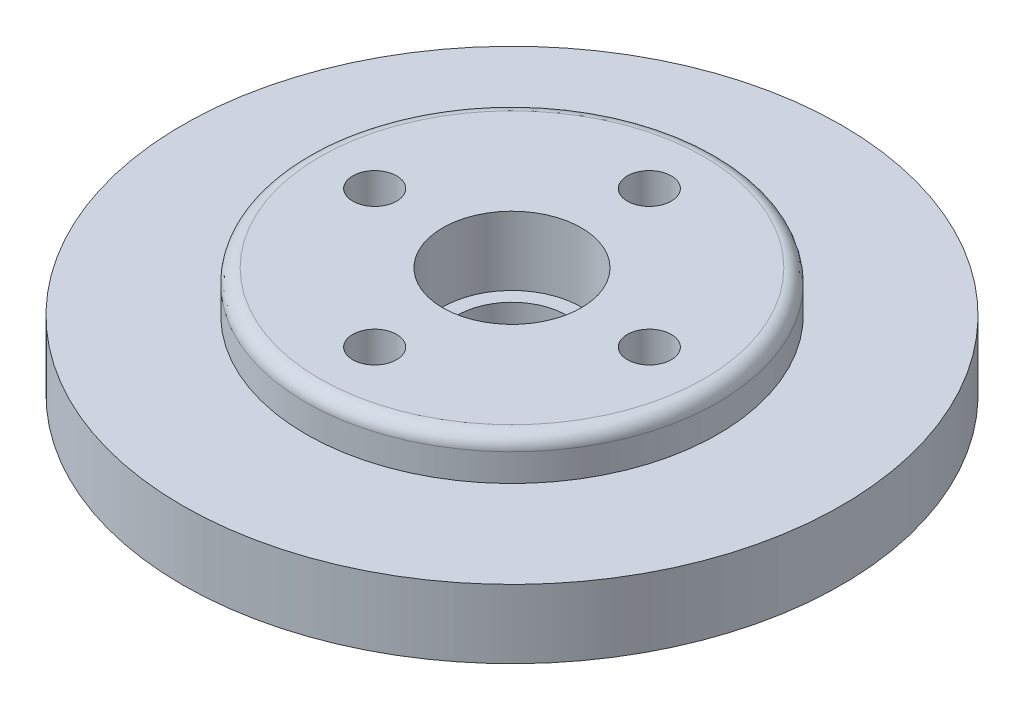
from build123d import *

# Parameters (mm, degrees)
SKETCH1_R           = 24
SKETCH1_R_2         = 4
BOSS_EXTRUDE1_DEPTH = 5
SKETCH2_R           = 15
BOSS_EXTRUDE2_DEPTH = 3
SKETCH4_R           = 5.05
CUT_EXTRUDE2_DEPTH  = 5
FILLET1_R           = 1
SKETCH5_R           = 1.6
CUT_EXTRUDE3_DEPTH  = 35.871191548
CUT_EXTRUDE15_DEPTH = 3


with BuildPart() as part:
    # Sketch1 → Boss-Extrude1 (new body)
    with BuildSketch(Plane(origin=(0, 0, 0), x_dir=(1, 0, 0), z_dir=(0, 1, 0))):
        with Locations(Location((0, 0, 0), (0, 0, 270))):
            Circle(SKETCH1_R)
        with Locations(Location((0, 0, 0), (0, 0, 270))):
            Circle(SKETCH1_R_2, mode=Mode.SUBTRACT)
    extrude(amount=BOSS_EXTRUDE1_DEPTH)

    # Sketch2 → Boss-Extrude2 (add)
    with BuildSketch(Plane(origin=(0, 5, 0), x_dir=(1, 0, 0), z_dir=(0, 1, 0))):
        with Locations(Location((0, 0, 0), (0, 0, 270))):
            Circle(SKETCH2_R)
    extrude(amount=BOSS_EXTRUDE2_DEPTH)

    # Sketch4 → Cut-Extrude2 (cut)
    with BuildSketch(Plane(origin=(0, 8, 0), x_dir=(1, 0, 0), z_dir=(0, 1, 0))):
        with Locations(Location((0, 0, 0), (0, 0, 270))):
            Circle(SKETCH4_R)
    extrude(amount=-CUT_EXTRUDE2_DEPTH, mode=Mode.SUBTRACT)

    # Fillet1
    fillet1_edges = [part.edges().sort_by_distance(p)[0] for p in [
        (0, 8, -15),
    ]]
    fillet(fillet1_edges, radius=FILLET1_R)

    # Sketch5 → Cut-Extrude3 (cut, through all)
    with BuildSketch(Plane(origin=(0, 8, 0), x_dir=(1, 0, 0), z_dir=(0, 1, 0))):
        with Locations(Location((0, 10, 0), (0, 0, 270))):
            Circle(SKETCH5_R)
        with Locations(Location((-10, 0, 0), (0, 0, 270))):
            Circle(SKETCH5_R)
        with Locations(Location((0, -10, 0), (0, 0, 270))):
            Circle(SKETCH5_R)
        with Locations(Location((10, 0, 0), (0, 0, 270))):
            Circle(SKETCH5_R)
    extrude(amount=-CUT_EXTRUDE3_DEPTH, mode=Mode.SUBTRACT)

    # Sketch10 → Cut-Extrude15 (cut)
    with BuildSketch(Plane.XZ):
        Polygon((10, -3.1), (12.684678752, -1.55), (12.684678752, 1.55), (10, 3.1), (7.315321248, 1.55), (7.315321248, -1.55), align=None)
        Polygon((3.1, 10), (1.55, 12.684678752), (-1.55, 12.684678752), (-3.1, 10), (-1.55, 7.315321248), (1.55, 7.315321248), align=None)
        Polygon((-3.1, -10), (-1.55, -12.684678752), (1.55, -12.684678752), (3.1, -10), (1.55, -7.315321248), (-1.55, -7.315321248), align=None)
        Polygon((-10, 3.1), (-12.684678752, 1.55), (-12.684678752, -1.55), (-10, -3.1), (-7.315321248, -1.55), (-7.315321248, 1.55), align=None)
    extrude(amount=-CUT_EXTRUDE15_DEPTH, mode=Mode.SUBTRACT)


solid = part.part
